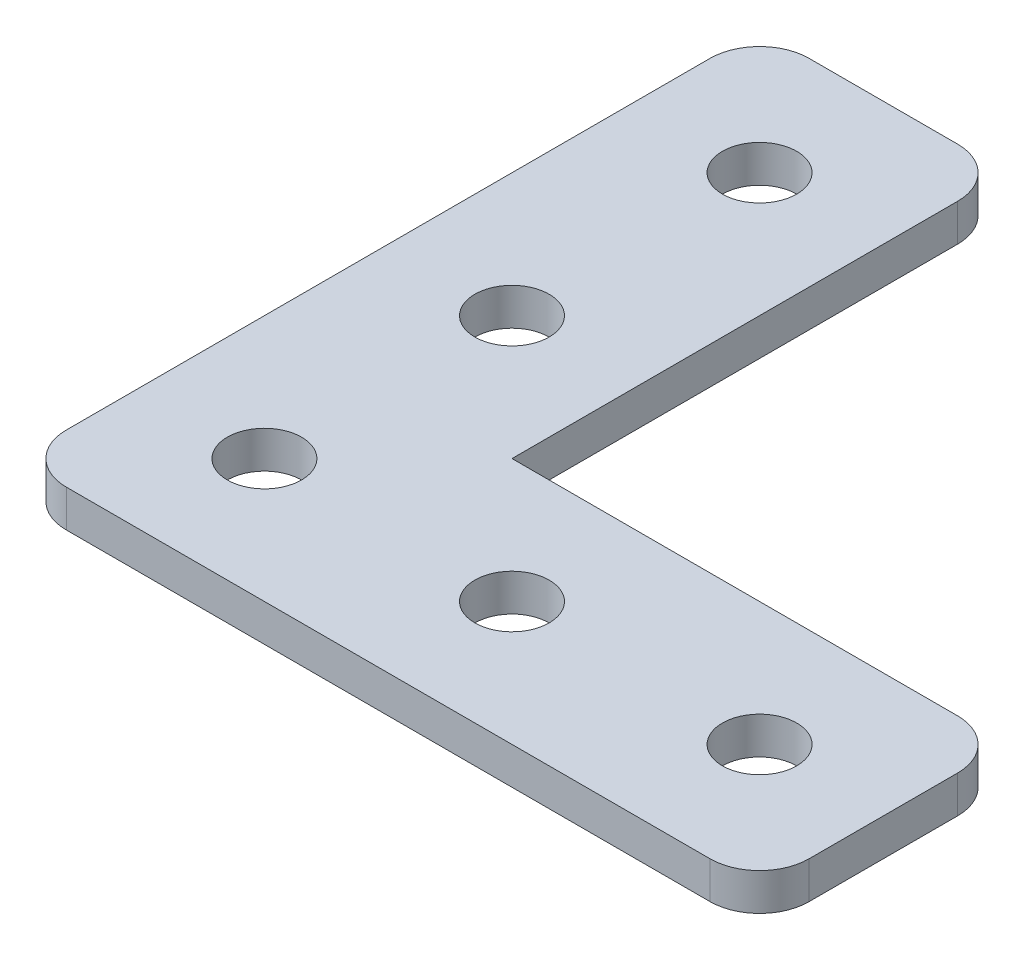
from build123d import *

# Parameters (mm, degrees)
SKETCH_2_R      = 1.5
EXTRUDE_1_DEPTH = 1.5
FILLET_1_R      = 2


with BuildPart() as part:
    # ｽｹｯﾁ2 → ﾎﾞｽ - 押し出し1 (new body)
    with BuildSketch(Plane(origin=(0, 0, 0), x_dir=(1, 0, 0), z_dir=(0, 1, 0))):
        Polygon((10, 10), (30, 10), (30, 0), (0, 0), (0, 30), (10, 30), align=None)
        with Locations(Location((5, 25, 0), (0, 0, 270))):
            Circle(SKETCH_2_R, mode=Mode.SUBTRACT)
        with Locations(Location((25, 5, 0), (0, 0, 270))):
            Circle(SKETCH_2_R, mode=Mode.SUBTRACT)
        with Locations(Location((5, 5, 0), (0, 0, 270))):
            Circle(SKETCH_2_R, mode=Mode.SUBTRACT)
        with Locations(Location((15, 5, 0), (0, 0, 270))):
            Circle(SKETCH_2_R, mode=Mode.SUBTRACT)
        with Locations(Location((5, 15, 0), (0, 0, 270))):
            Circle(SKETCH_2_R, mode=Mode.SUBTRACT)
    extrude(amount=EXTRUDE_1_DEPTH)

    # ﾌｨﾚｯﾄ1
    fillet_1_edges = [part.edges().sort_by_distance(p)[0] for p in [
        (30, 0.75, -10),
        (30, 0.75, 0),
        (0, 0.75, 0),
        (0, 0.75, -30),
        (10, 0.75, -30),
    ]]
    fillet(fillet_1_edges, radius=FILLET_1_R)


solid = part.part
